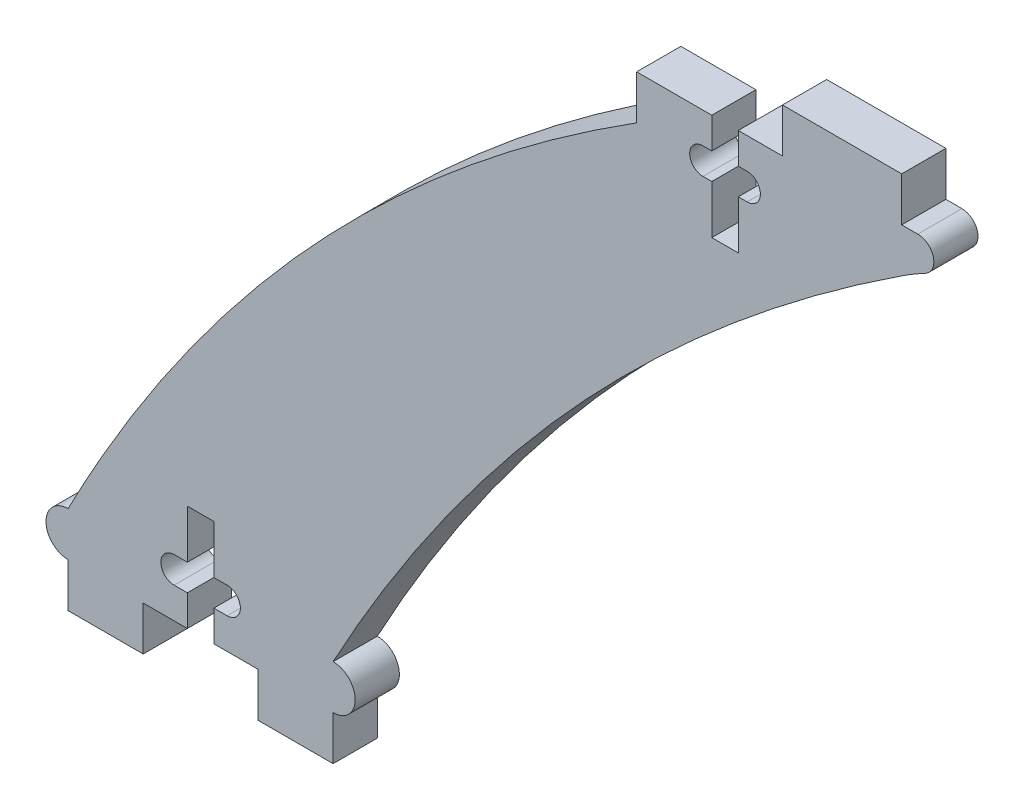
from build123d import *

# Parameters (mm, degrees)
SKETCH1_W           = 30
SKETCH1_H           = 5
BOSS_EXTRUDE1_DEPTH = 5
SKETCH3_OUTSIDE_W   = 121.122
SKETCH3_OUTSIDE_H   = 106.762
CUT_EXTRUDE1_DEPTH  = 10
SKETCH4_R           = 1.816989411
SKETCH4_W           = 8.5
SKETCH4_H           = 5
SKETCH4_R_2         = 2.5
BOSS_EXTRUDE2_DEPTH = 5


with BuildPart() as part:
    # Sketch1 → Boss-Extrude1 (new body)
    with BuildSketch(Plane.XY):
        with Locations((15, 2.5)):
            Rectangle(SKETCH1_W, SKETCH1_H)
        with BuildLine():
            add(Edge.make_bspline(
                [(94.36042114, 75), (53.195461928, 48.027295895), (30, 5)],
                knots=[0, 0, 0, 1, 1, 1], degree=2))
            Line((30, 5), (0, 5))
            add(Edge.make_bspline(
                [(64.36042114, 75), (22.658434304, 48.707086793), (0, 5)],
                knots=[0, 0, 0, 1, 1, 1], degree=2))
            Line((64.36042114, 75), (94.36042114, 75))
        make_face()
        with Locations((79.36042114, 77.5)):
            Rectangle(SKETCH1_W, SKETCH1_H)
    extrude(amount=BOSS_EXTRUDE1_DEPTH)

    # Sketch3 outside → Cut-Extrude1 (cut)
    with BuildSketch(Plane.XY.offset(5)):
        with Locations((47.18, 40)):
            Rectangle(SKETCH3_OUTSIDE_W, SKETCH3_OUTSIDE_H)
        with BuildLine():
            Line((72.86042114, 76.5), (72.86042114, 80))
            Line((72.86042114, 80), (64.36042114, 80))
            Line((64.36042114, 80), (64.36042114, 75))
            add(Edge.make_bspline(
                [(64.36042114, 75), (22.658434304, 48.707086793), (0, 5)],
                knots=[0, 0, 0, 1, 1, 1], degree=2))
            Line((0, 5), (0, 0))
            Line((0, 0), (13.5, 0))
            Line((13.5, 0), (13.5, 3.5))
            Line((13.5, 3.5), (12, 3.5))
            ThreePointArc((12, 3.5), (10.5, 5), (12, 6.5))
            Line((12, 6.5), (13.5, 6.5))
            Line((13.5, 6.5), (13.5, 12))
            Line((13.5, 12), (16.5, 12))
            Line((16.5, 12), (16.5, 6.5))
            Line((16.5, 6.5), (18, 6.5))
            ThreePointArc((18, 6.5), (19.5, 5), (18, 3.5))
            Line((18, 3.5), (16.5, 3.5))
            Line((16.5, 3.5), (16.5, 0))
            Line((16.5, 0), (30, 0))
            Line((30, 0), (30, 5))
            add(Edge.make_bspline(
                [(30, 5), (53.195461928, 48.027295895), (94.36042114, 75)],
                knots=[0, 0, 0, 1, 1, 1], degree=2))
            Line((94.36042114, 75), (94.36042114, 80))
            Line((94.36042114, 80), (75.86042114, 80))
            Line((75.86042114, 80), (75.86042114, 76.5))
            Line((75.86042114, 76.5), (76.86042114, 76.5))
            ThreePointArc((76.86042114, 76.5), (78.36042114, 75), (76.86042114, 73.5))
            Line((76.86042114, 73.5), (75.86042114, 73.5))
            Line((75.86042114, 73.5), (75.86042114, 68))
            Line((75.86042114, 68), (72.86042114, 68))
            Line((72.86042114, 68), (72.86042114, 73.5))
            Line((72.86042114, 73.5), (71.86042114, 73.5))
            ThreePointArc((71.86042114, 73.5), (70.36042114, 75), (71.86042114, 76.5))
            Line((71.86042114, 76.5), (72.86042114, 76.5))
        make_face(mode=Mode.SUBTRACT)
    extrude(amount=-CUT_EXTRUDE1_DEPTH, mode=Mode.SUBTRACT)

    # Sketch4 → Boss-Extrude2 (add)
    with BuildSketch(Plane.XY.offset(5)):
        Polygon((94.285794486, 80), (94.36042114, 80), (94.36042114, 85), (80.86042114, 85), (80.86042114, 80), align=None)
        with Locations((96.177410551, 78.183010589)):
            Circle(SKETCH4_R)
        with BuildLine():
            Line((96.177410551, 80), (94.36042114, 80))
            Line((94.36042114, 80), (94.36042114, 78.183010589))
            ThreePointArc((94.36042114, 78.183010589), (94.892605017, 79.467816123), (96.177410551, 80))
        make_face()
        with BuildLine():
            ThreePointArc((97.020667914, 76.573548711), (95.23686262, 76.628398062), (94.36042114, 78.183010589))
            Line((94.36042114, 78.183010589), (94.36042114, 75))
            ThreePointArc((94.36042114, 75), (95.670266462, 75.821056521), (97.020667914, 76.573548711))
        make_face()
        with Locations((25.75, -2.5)):
            Rectangle(SKETCH4_W, SKETCH4_H)
        with Locations((4.25, -2.5)):
            Rectangle(SKETCH4_W, SKETCH4_H)
        with BuildLine():
            Line((30, 5), (30, 0))
            ThreePointArc((30, 0), (31.767766953, 0.732233047), (32.5, 2.5))
            ThreePointArc((32.5, 2.5), (31.767766953, 4.267766953), (30, 5))
        make_face()
        with BuildLine():
            ThreePointArc((30, 5), (27.5, 2.5), (30, 0))
            Line((30, 0), (30, 5))
        make_face()
        with Locations((0, 2.5)):
            Circle(SKETCH4_R_2)
    extrude(amount=-BOSS_EXTRUDE2_DEPTH)


solid = part.part
